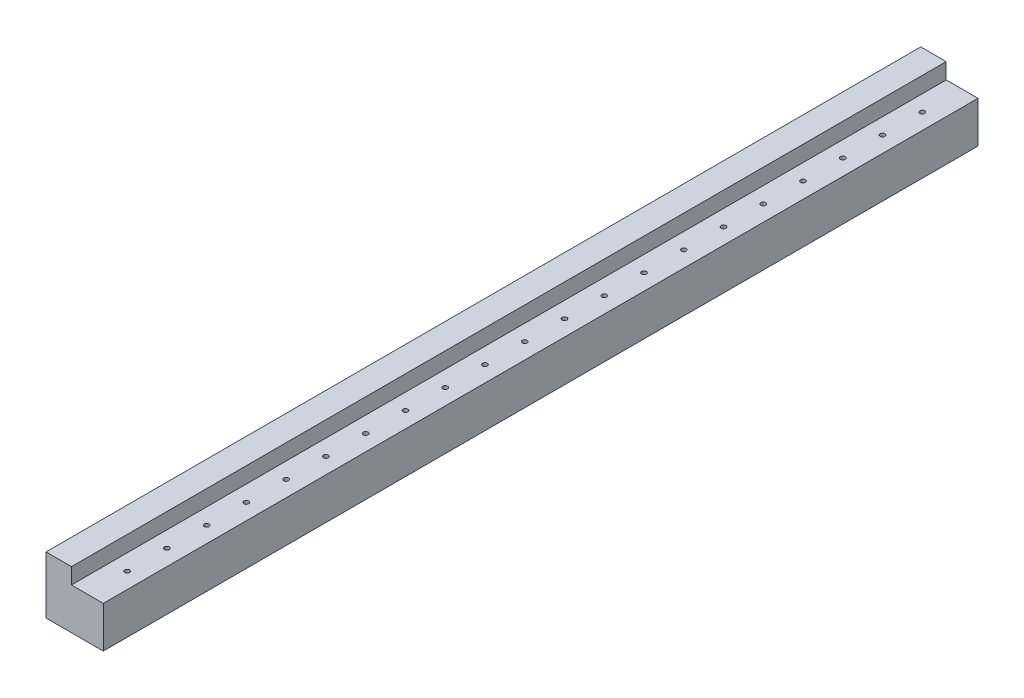
from build123d import *

# Parameters (mm, degrees)
ESQUISSE1_W                    = 36
ESQUISSE1_H                    = 36
BOSS_EXTRU_1_DEPTH             = 550
ENL_V_MAT_EXTRU_1_DEPTH        = 551.588775766
ENL_V_MAT_EXTRU_1_DEPTH_BACK   = 551.588775766
ESQUISSE2_W                    = 20
ESQUISSE2_H                    = 10
ESQUISSE3_R                    = 1.5
ENL_V_MAT_EXTRU_2_DEPTH        = 20
R_P_TITION_LIN_AIRE1_COUNT     = 11
R_P_TITION_LIN_AIRE1_PITCH     = 25
R_P_TITION_LIN_AIRE1_COL_COUNT = 11
R_P_TITION_LIN_AIRE1_COL_PITCH = 25


with BuildPart() as part:
    # Esquisse1 → Boss.-Extru.1 (new body)
    with BuildSketch(Plane.XY):
        Rectangle(ESQUISSE1_W, ESQUISSE1_H)
    extrude(amount=BOSS_EXTRU_1_DEPTH)

    # Esquisse2 → Enlèv. mat.-Extru.1 (cut, two sides: drawn at the far end of the back side and taken through both)
    with BuildSketch(Plane.XY.offset(550).offset(-ENL_V_MAT_EXTRU_1_DEPTH_BACK)):
        with Locations((8, 13)):
            Rectangle(ESQUISSE2_W, ESQUISSE2_H)
    extrude(amount=ENL_V_MAT_EXTRU_1_DEPTH + ENL_V_MAT_EXTRU_1_DEPTH_BACK, mode=Mode.SUBTRACT)

    # Esquisse3 → Enlèv. mat.-Extru.2 (cut)
    with BuildSketch(Plane(origin=(0, 8, 0), x_dir=(1, 0, 0), z_dir=(0, 1, 0))):
        with Locations(Location((8, -275, 0), (0, 0, 180))):
            Circle(ESQUISSE3_R)
    enl_v_mat_extru_2 = extrude(amount=-ENL_V_MAT_EXTRU_2_DEPTH, mode=Mode.SUBTRACT)

    # Répétition linéaire1: Enlèv. mat.-Extru.2 ×11
    with Locations(*[(0, 0, -i * R_P_TITION_LIN_AIRE1_PITCH) for i in range(1, R_P_TITION_LIN_AIRE1_COUNT)]):
        add(enl_v_mat_extru_2, mode=Mode.SUBTRACT)

    # Répétition linéaire1 col: Enlèv. mat.-Extru.2 ×11
    with Locations(*[(0, 0, i * R_P_TITION_LIN_AIRE1_COL_PITCH) for i in range(1, R_P_TITION_LIN_AIRE1_COL_COUNT)]):
        add(enl_v_mat_extru_2, mode=Mode.SUBTRACT)


solid = part.part
